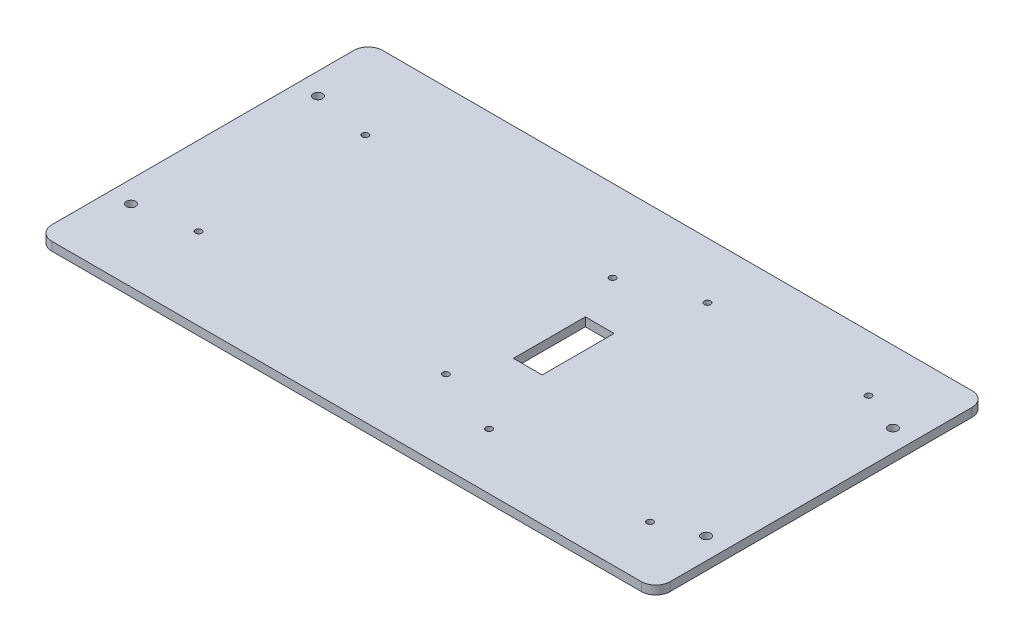
from build123d import *

# Parameters (mm, degrees)
SKETCH1_W           = 215
SKETCH1_H           = 115
SKETCH1_R           = 1.6
SKETCH1_R_2         = 1.1
SKETCH1_W_2         = 10
SKETCH1_H_2         = 25
BOSS_EXTRUDE1_DEPTH = 3
FILLET1_R           = 5


with BuildPart() as part:
    # Sketch1 → Boss-Extrude1 (new body)
    with BuildSketch(Plane(origin=(0, 0, 0), x_dir=(1, 0, 0), z_dir=(0, 1, 0))):
        Rectangle(SKETCH1_W, SKETCH1_H)
        with Locations(Location((100, -32.5, 0), (0, 0, 270))):
            Circle(SKETCH1_R, mode=Mode.SUBTRACT)
        with Locations(Location((-100, -32.5, 0), (0, 0, 90))):
            Circle(SKETCH1_R, mode=Mode.SUBTRACT)
        with Locations(Location((100, 32.5, 0), (0, 0, 90))):
            Circle(SKETCH1_R, mode=Mode.SUBTRACT)
        with Locations(Location((-100, 32.5, 0), (0, 0, 270))):
            Circle(SKETCH1_R, mode=Mode.SUBTRACT)
        with Locations(Location((-80, 29, 0), (0, 0, 270))):
            Circle(SKETCH1_R_2, mode=Mode.SUBTRACT)
        with Locations(Location((-80, -29, 0), (0, 0, 90))):
            Circle(SKETCH1_R_2, mode=Mode.SUBTRACT)
        with Locations(Location((30, 38, 0), (0, 0, 270))):
            Circle(SKETCH1_R_2, mode=Mode.SUBTRACT)
        with Locations(Location((86, 38, 0), (0, 0, 270))):
            Circle(SKETCH1_R_2, mode=Mode.SUBTRACT)
        with Locations(Location((86, -38, 0), (0, 0, 90))):
            Circle(SKETCH1_R_2, mode=Mode.SUBTRACT)
        with Locations(Location((30, -38, 0), (0, 0, 90))):
            Circle(SKETCH1_R_2, mode=Mode.SUBTRACT)
        with Locations(Location((6, 29, 0), (0, 0, 270))):
            Circle(SKETCH1_R_2, mode=Mode.SUBTRACT)
        with Locations(Location((6, -29, 0), (0, 0, 90))):
            Circle(SKETCH1_R_2, mode=Mode.SUBTRACT)
        with Locations((18, 0)):
            Rectangle(SKETCH1_W_2, SKETCH1_H_2, mode=Mode.SUBTRACT)
    extrude(amount=BOSS_EXTRUDE1_DEPTH)

    # Fillet1
    fillet1_edges = [part.edges().sort_by_distance(p)[0] for p in [
        (107.5, 1.5, 57.5),
        (-107.5, 1.5, 57.5),
        (-107.5, 1.5, -57.5),
        (107.5, 1.5, -57.5),
    ]]
    fillet(fillet1_edges, radius=FILLET1_R)


solid = part.part
